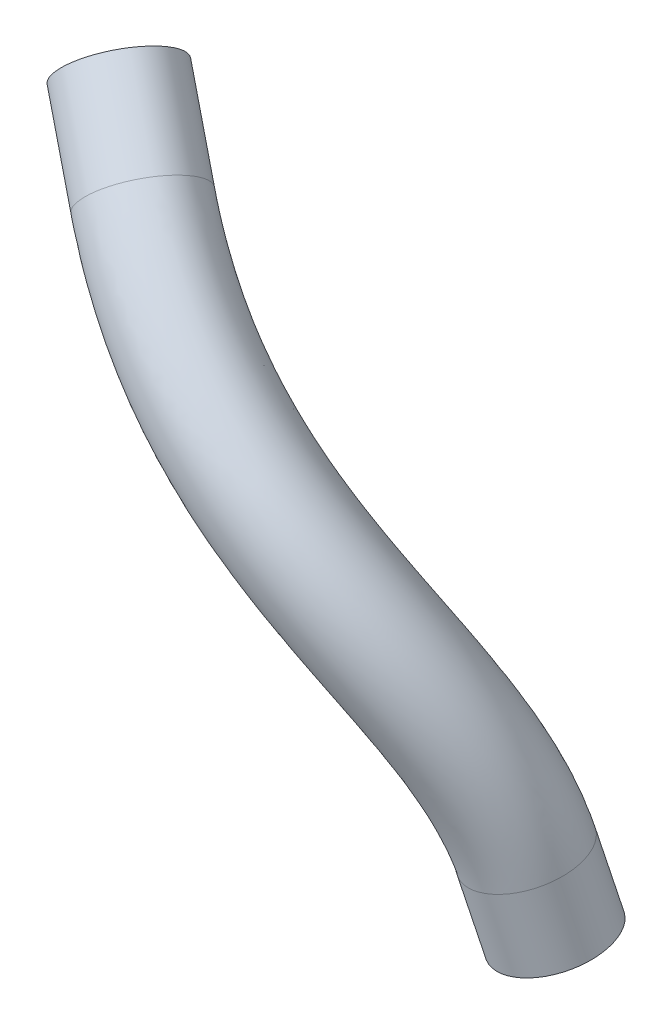
from build123d import *

# Parameters (mm, degrees)
SWEEP1_PROFILE_R     = 13.49375
CUT_SWEEP1_PROFILE_R = 9.525


with BuildPart() as part:
    # Sweep1: sweep along a curve in space
    with BuildLine() as sweep1_path:
        Line((27.501516454, -11.100021656, -13.942942833), (23.095618699, 7.173839424, -10.851573197))
        add(Edge.make_bspline(
            [(23.095618699, 7.173839424, -10.851573197), (13.261070206, 47.963522462, -3.951225916), (-24.99522441, 69.205871428, 24.49264735), (-71.502710672, 110.316771936, -5.131837889)],
            knots=[0, 0, 0, 0, 1, 1, 1, 1], degree=3))
        Line((-71.502710672, 110.316771936, -5.131837889), (-88.677665299, 125.498797619, -16.07199464))
    # Sweep1 profile (on start of the path) → Sweep1 (sweep)
    with BuildSketch(Plane(origin=(27.501516454, -11.100021656, -13.942942833), x_dir=(0.9721432612515079, 0.2343874561560038, 0), z_dir=(-0.23128072205980535, 0.9592577994369071, 0.1622766213074379))):
        Circle(SWEEP1_PROFILE_R)
    sweep(path=sweep1_path.line)

    # Cut-Sweep1: sweep along a curve in space
    with BuildLine() as cut_sweep1_path:
        Line((27.501516454, -11.100021656, -13.942942833), (23.095618699, 7.173839424, -10.851573197))
        add(Edge.make_bspline(
            [(23.095618699, 7.173839424, -10.851573197), (13.261070206, 47.963522462, -3.951225916), (-24.99522441, 69.205871428, 24.49264735), (-71.502710672, 110.316771936, -5.131837889)],
            knots=[0, 0, 0, 0, 1, 1, 1, 1], degree=3))
        Line((-71.502710672, 110.316771936, -5.131837889), (-88.677665299, 125.498797619, -16.07199464))
    # Cut-Sweep1 profile (on start of the path) → Cut-Sweep1 (sweep, cut)
    with BuildSketch(Plane(origin=(27.501516454, -11.100021656, -13.942942833), x_dir=(0.9721432612515079, 0.2343874561560038, 0), z_dir=(-0.23128072205980535, 0.9592577994369071, 0.1622766213074379))):
        Circle(CUT_SWEEP1_PROFILE_R)
    sweep(path=cut_sweep1_path.line, mode=Mode.SUBTRACT)


solid = part.part
